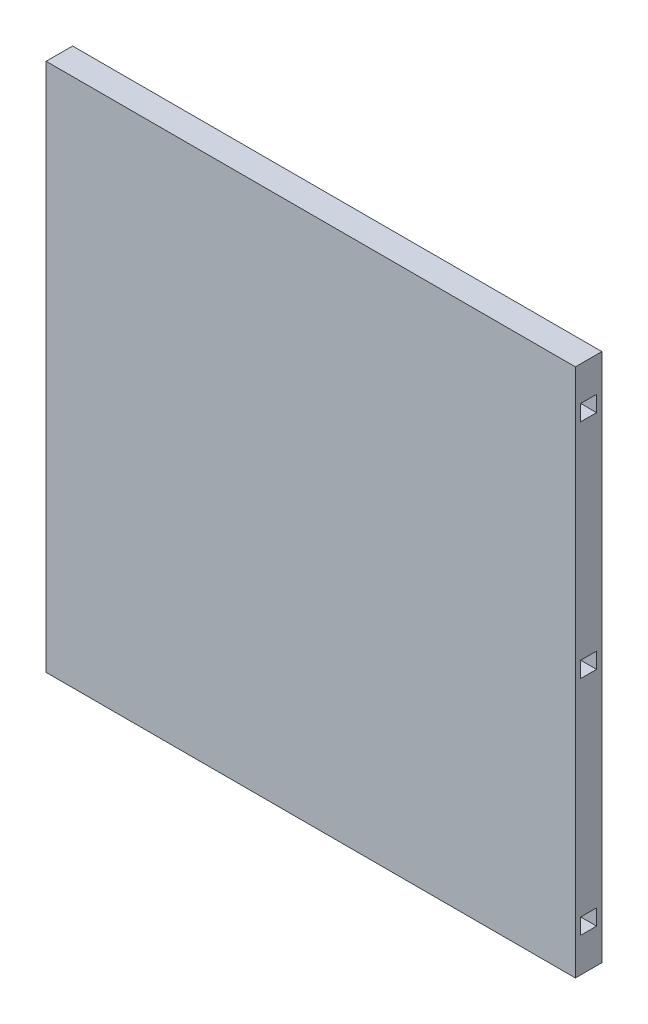
from build123d import *

# Parameters (mm, degrees)
SKETCH2_W           = 100
SKETCH2_H           = 100
BOSS_EXTRUDE1_DEPTH = 5
SKETCH3_W           = 1.5
SKETCH3_H           = 3
SKETCH3_W_2         = 3
SKETCH3_H_2         = 1.5
CUT_EXTRUDE1_DEPTH  = 5
SKETCH6_W           = 3
SKETCH6_H           = 3
CUT_EXTRUDE2_DEPTH  = 5


with BuildPart() as part:
    # Sketch2 → Boss-Extrude1 (new body)
    with BuildSketch(Plane.XY):
        Rectangle(SKETCH2_W, SKETCH2_H)
    extrude(amount=BOSS_EXTRUDE1_DEPTH)

    # Sketch3 → Cut-Extrude1 (cut)
    with BuildSketch(Plane(origin=(50, 0, 0), x_dir=(0, 0, -1), z_dir=(1, 0, 0))):
        with Locations((-1.75, 42.009272938)):
            Rectangle(SKETCH3_W, SKETCH3_H)
        with Locations((-3.25, 42.009272938)):
            Rectangle(SKETCH3_W, SKETCH3_H)
        with Locations((-2.5, -0.75)):
            Rectangle(SKETCH3_W_2, SKETCH3_H_2)
        with Locations((-2.5, 0.75)):
            Rectangle(SKETCH3_W_2, SKETCH3_H_2)
        with Locations((-2.5, -42.009272938)):
            Rectangle(SKETCH3_W_2, SKETCH3_H)
    extrude(amount=-CUT_EXTRUDE1_DEPTH, mode=Mode.SUBTRACT)

    # Sketch6 → Cut-Extrude2 (cut)
    with BuildSketch(Plane.XZ.offset(50)):
        with Locations((-47.5, 2.5)):
            Rectangle(SKETCH6_W, SKETCH6_H)
        with Locations((47.5, 2.5)):
            Rectangle(SKETCH6_W, SKETCH6_H)
        with Locations((0, 2.5)):
            Rectangle(SKETCH6_W, SKETCH6_H)
    extrude(amount=-CUT_EXTRUDE2_DEPTH, mode=Mode.SUBTRACT)


solid = part.part
